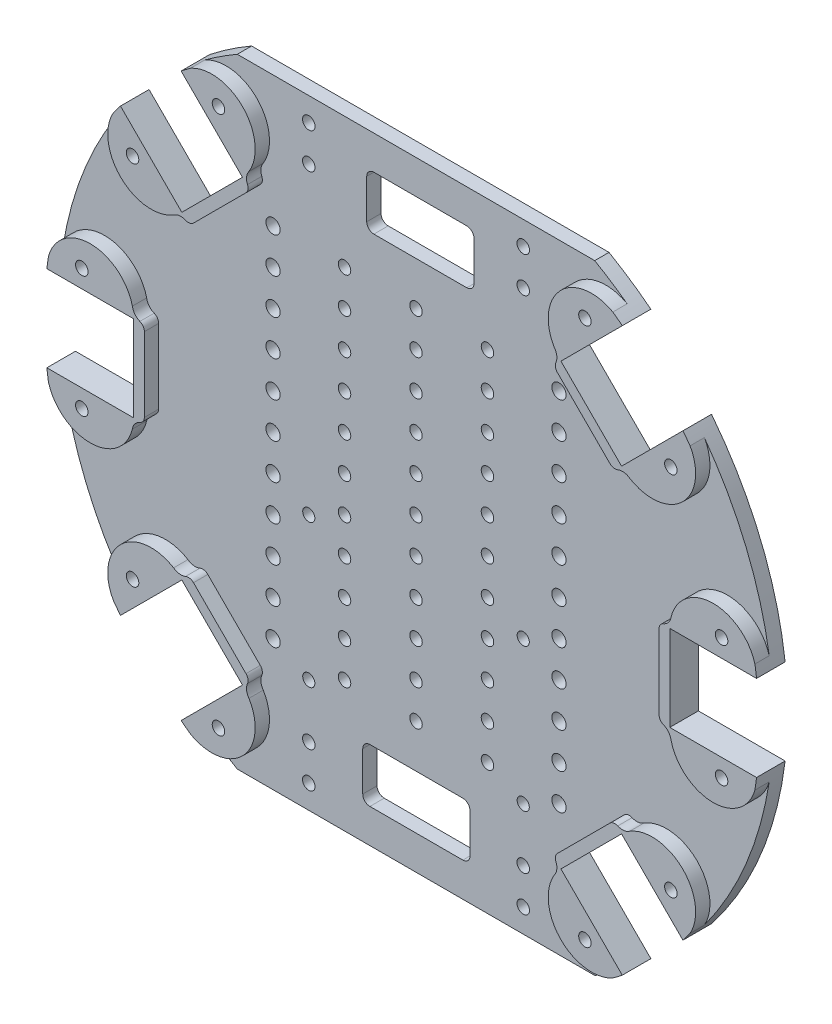
from build123d import *

# Parameters (mm, degrees)
SKETCH1_R           = 1.75
BOSS_EXTRUDE1_DEPTH = 4
SKETCH2_R           = 1.75
SKETCH2_R_2         = 2
SKETCH2_R_3         = 1.7
CUT_EXTRUDE1_DEPTH  = 10
SKETCH3_R           = 1.75
BOSS_EXTRUDE2_DEPTH = 4
CUT_EXTRUDE2_DEPTH  = 10
CUT_EXTRUDE3_DEPTH  = 141.968081494


with BuildPart() as part:
    # Sketch1 → Boss-Extrude1 (new body)
    with BuildSketch(Plane.XY):
        with BuildLine():
            Line((61.518289963, 44.547727215), (44.547727215, 61.518289963))
            Line((44.547727215, 61.518289963), (61.714433725, 78.684996473))
            ThreePointArc((61.714433725, 78.684996473), (0, 100), (-61.714433725, 78.684996473))
            Line((-61.714433725, 78.684996473), (-44.547727215, 61.518289963))
            Line((-44.547727215, 61.518289963), (-61.518289963, 44.547727215))
            Line((-61.518289963, 44.547727215), (-78.684996473, 61.714433725))
            ThreePointArc((-78.684996473, 61.714433725), (-92.387953251, 38.268343237), (-99.277389168, 12))
            Line((-99.277389168, 12), (-75, 12))
            Line((-75, 12), (-75, -12))
            Line((-75, -12), (-99.277389168, -12))
            ThreePointArc((-99.277389168, -12), (-92.387953251, -38.268343237), (-78.684996473, -61.714433725))
            Line((-78.684996473, -61.714433725), (-61.518289963, -44.547727215))
            Line((-61.518289963, -44.547727215), (-44.547727215, -61.518289963))
            Line((-44.547727215, -61.518289963), (-61.714433725, -78.684996473))
            ThreePointArc((-61.714433725, -78.684996473), (0, -100), (61.714433725, -78.684996473))
            Line((61.714433725, -78.684996473), (44.547727215, -61.518289963))
            Line((44.547727215, -61.518289963), (61.518289963, -44.547727215))
            Line((61.518289963, -44.547727215), (78.684996473, -61.714433725))
            ThreePointArc((78.684996473, -61.714433725), (92.387953251, -38.268343237), (99.277389168, -12))
            Line((99.277389168, -12), (75, -12))
            Line((75, -12), (75, 12))
            Line((75, 12), (99.277389168, 12))
            ThreePointArc((99.277389168, 12), (92.387953251, 38.268343237), (78.684996473, 61.714433725))
            Line((78.684996473, 61.714433725), (61.518289963, 44.547727215))
        make_face()
        with Locations((-51.265241636, -75.306872196)):
            Circle(SKETCH1_R, mode=Mode.SUBTRACT)
        with Locations((-75.306872196, -51.265241636)):
            Circle(SKETCH1_R, mode=Mode.SUBTRACT)
        with Locations((-89.5, -17)):
            Circle(SKETCH1_R, mode=Mode.SUBTRACT)
        with Locations((51.265241636, -75.306872196)):
            Circle(SKETCH1_R, mode=Mode.SUBTRACT)
        with Locations((75.306872196, -51.265241636)):
            Circle(SKETCH1_R, mode=Mode.SUBTRACT)
        with Locations((89.5, -17)):
            Circle(SKETCH1_R, mode=Mode.SUBTRACT)
        with Locations((-89.5, 17)):
            Circle(SKETCH1_R, mode=Mode.SUBTRACT)
        with Locations((-75.306872196, 51.265241636)):
            Circle(SKETCH1_R, mode=Mode.SUBTRACT)
        with Locations((-51.265241636, 75.306872196)):
            Circle(SKETCH1_R, mode=Mode.SUBTRACT)
        with Locations((89.5, 17)):
            Circle(SKETCH1_R, mode=Mode.SUBTRACT)
        with Locations((75.306872196, 51.265241636)):
            Circle(SKETCH1_R, mode=Mode.SUBTRACT)
        with Locations((51.265241636, 75.306872196)):
            Circle(SKETCH1_R, mode=Mode.SUBTRACT)
    extrude(amount=BOSS_EXTRUDE1_DEPTH)

    # Sketch2 → Cut-Extrude1 (cut)
    with BuildSketch(Plane.XY.offset(4)):
        with Locations((0, 40)):
            Circle(SKETCH2_R)
        with Locations((-40, 40)):
            Circle(SKETCH2_R_2)
        with Locations((-20, 40)):
            Circle(SKETCH2_R)
        with Locations((-40, 50)):
            Circle(SKETCH2_R_2)
        with Locations((-20, 50)):
            Circle(SKETCH2_R)
        with Locations((-30, 70)):
            Circle(SKETCH2_R)
        with Locations((-30, 80)):
            Circle(SKETCH2_R)
        with Locations((30, 80)):
            Circle(SKETCH2_R)
        with Locations((30, 70)):
            Circle(SKETCH2_R)
        with Locations((40, 50)):
            Circle(SKETCH2_R_2)
        with Locations((20, 50)):
            Circle(SKETCH2_R)
        with Locations((0, 50)):
            Circle(SKETCH2_R)
        with Locations((40, 40)):
            Circle(SKETCH2_R_2)
        with Locations((20, 40)):
            Circle(SKETCH2_R)
        with Locations((30, -80)):
            Circle(SKETCH2_R)
        with Locations((-30, -80)):
            Circle(SKETCH2_R)
        with Locations((30, -70)):
            Circle(SKETCH2_R)
        with Locations((-30, -70)):
            Circle(SKETCH2_R)
        with Locations((0, 10)):
            Circle(SKETCH2_R)
        with Locations((-40, 10)):
            Circle(SKETCH2_R_2)
        with Locations((-20, 10)):
            Circle(SKETCH2_R)
        with Locations((40, 10)):
            Circle(SKETCH2_R_2)
        with Locations((20, 10)):
            Circle(SKETCH2_R)
        with Locations((0, 20)):
            Circle(SKETCH2_R)
        with Locations((-40, 20)):
            Circle(SKETCH2_R_2)
        with Locations((-20, 20)):
            Circle(SKETCH2_R)
        with Locations((40, 20)):
            Circle(SKETCH2_R_2)
        with Locations((20, 20)):
            Circle(SKETCH2_R)
        with Locations((0, 30)):
            Circle(SKETCH2_R)
        with Locations((-40, 30)):
            Circle(SKETCH2_R_2)
        with Locations((-20, 30)):
            Circle(SKETCH2_R)
        with Locations((40, 30)):
            Circle(SKETCH2_R_2)
        with Locations((20, 30)):
            Circle(SKETCH2_R)
        with Locations((0, -10)):
            Circle(SKETCH2_R)
        with Locations((40, -10)):
            Circle(SKETCH2_R_2)
        with Locations((20, -10)):
            Circle(SKETCH2_R)
        with Locations((-40, -10)):
            Circle(SKETCH2_R_2)
        with Locations((-20, -10)):
            Circle(SKETCH2_R)
        with Locations((0, -20)):
            Circle(SKETCH2_R)
        with Locations((40, -20)):
            Circle(SKETCH2_R_2)
        with Locations((20, -20)):
            Circle(SKETCH2_R)
        with Locations((-40, -20)):
            Circle(SKETCH2_R_2)
        with Locations((-20, -20)):
            Circle(SKETCH2_R)
        with Locations((0, -30)):
            Circle(SKETCH2_R)
        with Locations((40, -30)):
            Circle(SKETCH2_R_2)
        with Locations((20, -30)):
            Circle(SKETCH2_R)
        with Locations((-40, -30)):
            Circle(SKETCH2_R_2)
        with Locations((-20, -30)):
            Circle(SKETCH2_R)
        with Locations((0, -40)):
            Circle(SKETCH2_R)
        with Locations((40, -40)):
            Circle(SKETCH2_R_2)
        with Locations((20, -40)):
            Circle(SKETCH2_R)
        with Locations((-40, -40)):
            Circle(SKETCH2_R_2)
        with Locations((-20, -40)):
            Circle(SKETCH2_R)
        with Locations((0, -50)):
            Circle(SKETCH2_R)
        with Locations((40, -50)):
            Circle(SKETCH2_R_2)
        with Locations((20, -50)):
            Circle(SKETCH2_R)
        with Locations((-40, -50)):
            Circle(SKETCH2_R_2)
        with Locations((-20, -50)):
            Circle(SKETCH2_R)
        with Locations((-30, -55)):
            Circle(SKETCH2_R_3)
        with Locations((-30, -15)):
            Circle(SKETCH2_R_3)
        with Locations((30, -55)):
            Circle(SKETCH2_R_3)
        with Locations((30, -15)):
            Circle(SKETCH2_R_3)
        with Locations((-40, 0)):
            Circle(SKETCH2_R_2)
        with Locations((-20, 0)):
            Circle(SKETCH2_R)
        Circle(SKETCH2_R)
        with Locations((40, 0)):
            Circle(SKETCH2_R_2)
        with Locations((20, 0)):
            Circle(SKETCH2_R)
    extrude(amount=-CUT_EXTRUDE1_DEPTH, mode=Mode.SUBTRACT)

    # Sketch3 → Boss-Extrude2 (add)
    # profile 1 of 19: a face of its own
    with BuildSketch(Plane.XY.offset(4)):
        with BuildLine():
            ThreePointArc((42.745208303, -63.818207412), (44.40985161, -78.544869697), (59.074881311, -80.685552598))
            ThreePointArc((59.074881311, -80.685552598), (60.402940433, -79.696203091), (61.714433725, -78.684996473))
            Line((61.714433725, -78.684996473), (44.547727215, -61.518289963))
            ThreePointArc((44.547727215, -61.518289963), (43.738044879, -62.41276888), (43.021158129, -63.383207651))
            ThreePointArc((43.021158129, -63.383207651), (42.89146595, -63.605961831), (42.745208303, -63.818207412))
        make_face()
        with Locations((51.265241636, -75.306872196)):
            Circle(SKETCH3_R, mode=Mode.SUBTRACT)
    # profile 2 of 19: a face of its own
    with BuildSketch(Plane.XY.offset(4)):
        with BuildLine():
            ThreePointArc((43.021158129, -63.383207651), (43.738044879, -62.41276888), (44.547727215, -61.518289963))
            Line((44.547727215, -61.518289963), (61.518289963, -44.547727215))
            ThreePointArc((61.518289963, -44.547727215), (62.41276888, -43.738044879), (63.383207651, -43.021158129))
            ThreePointArc((63.383207651, -43.021158129), (61.934255267, -43.415364041), (60.457290906, -43.144370333))
            ThreePointArc((60.457290906, -43.144370333), (59.291136488, -43.01863263), (58.255022397, -43.568354094))
            Line((58.255022397, -43.568354094), (43.568354094, -58.255022397))
            ThreePointArc((43.568354094, -58.255022397), (43.01863263, -59.291136488), (43.144370333, -60.457290906))
            ThreePointArc((43.144370333, -60.457290906), (43.415364041, -61.934255267), (43.021158129, -63.383207651))
        make_face()
    # profile 3 of 19: a face of its own
    with BuildSketch(Plane.XY.offset(4)):
        with BuildLine():
            ThreePointArc((78.684996473, -61.714433725), (79.696203091, -60.402940433), (80.685552598, -59.074881311))
            ThreePointArc((80.685552598, -59.074881311), (78.544869697, -44.40985161), (63.818207412, -42.745208303))
            ThreePointArc((63.818207412, -42.745208303), (63.605961831, -42.89146595), (63.383207651, -43.021158129))
            ThreePointArc((63.383207651, -43.021158129), (62.41276888, -43.738044879), (61.518289963, -44.547727215))
            Line((61.518289963, -44.547727215), (78.684996473, -61.714433725))
        make_face()
        with Locations((75.306872196, -51.265241636)):
            Circle(SKETCH3_R, mode=Mode.SUBTRACT)
    # profile 4 of 19: a face of its own
    with BuildSketch(Plane.XY.offset(4)):
        with BuildLine():
            Line((99.277389168, -12), (75, -12))
            ThreePointArc((75, -12), (75.059960237, -13.205023978), (75.239248591, -14.398143296))
            ThreePointArc((75.239248591, -14.398143296), (75.305053363, -14.647360506), (75.351713878, -14.90086057))
            ThreePointArc((75.351713878, -14.90086057), (86.942117215, -24.137102766), (98.825550559, -15.281052213))
            ThreePointArc((98.825550559, -15.281052213), (99.065054424, -13.642396857), (99.277389168, -12))
        make_face()
        with Locations((89.5, -17)):
            Circle(SKETCH3_R, mode=Mode.SUBTRACT)
    # profile 5 of 19: a face of its own
    with BuildSketch(Plane.XY.offset(4)):
        with BuildLine():
            Line((75, -12), (75, 12))
            ThreePointArc((75, 12), (75.059960237, 13.205023978), (75.239248591, 14.398143296))
            ThreePointArc((75.239248591, 14.398143296), (74.493430208, 13.094833565), (73.257437204, 12.242083539))
            ThreePointArc((73.257437204, 12.242083539), (72.343931524, 11.506397825), (72, 10.38504275))
            Line((72, 10.38504275), (72, -10.38504275))
            ThreePointArc((72, -10.38504275), (72.343931524, -11.506397825), (73.257437204, -12.242083539))
            ThreePointArc((73.257437204, -12.242083539), (74.493430208, -13.094833565), (75.239248591, -14.398143296))
            ThreePointArc((75.239248591, -14.398143296), (75.059960237, -13.205023978), (75, -12))
        make_face()
    # profile 6 of 19: a face of its own
    with BuildSketch(Plane.XY.offset(4)):
        with BuildLine():
            ThreePointArc((99.277389168, 12), (99.065054424, 13.642396857), (98.825550559, 15.281052213))
            ThreePointArc((98.825550559, 15.281052213), (86.942117215, 24.137102766), (75.351713878, 14.90086057))
            ThreePointArc((75.351713878, 14.90086057), (75.305053363, 14.647360506), (75.239248591, 14.398143296))
            ThreePointArc((75.239248591, 14.398143296), (75.059960237, 13.205023978), (75, 12))
            Line((75, 12), (99.277389168, 12))
        make_face()
        with Locations((89.5, 17)):
            Circle(SKETCH3_R, mode=Mode.SUBTRACT)
    # profile 7 of 19: a face of its own
    with BuildSketch(Plane.XY.offset(4)):
        with BuildLine():
            ThreePointArc((80.685552598, 59.074881311), (79.696203091, 60.402940433), (78.684996473, 61.714433725))
            Line((78.684996473, 61.714433725), (61.518289963, 44.547727215))
            ThreePointArc((61.518289963, 44.547727215), (62.41276888, 43.738044879), (63.383207651, 43.021158129))
            ThreePointArc((63.383207651, 43.021158129), (63.605961831, 42.89146595), (63.818207412, 42.745208303))
            ThreePointArc((63.818207412, 42.745208303), (78.544869697, 44.40985161), (80.685552598, 59.074881311))
        make_face()
        with Locations((75.306872196, 51.265241636)):
            Circle(SKETCH3_R, mode=Mode.SUBTRACT)
    # profile 8 of 19: a face of its own
    with BuildSketch(Plane.XY.offset(4)):
        with BuildLine():
            Line((61.518289963, 44.547727215), (44.547727215, 61.518289963))
            ThreePointArc((44.547727215, 61.518289963), (43.738044879, 62.41276888), (43.021158129, 63.383207651))
            ThreePointArc((43.021158129, 63.383207651), (43.415364041, 61.934255267), (43.144370333, 60.457290906))
            ThreePointArc((43.144370333, 60.457290906), (43.01863263, 59.291136488), (43.568354094, 58.255022397))
            Line((43.568354094, 58.255022397), (58.255022397, 43.568354094))
            ThreePointArc((58.255022397, 43.568354094), (59.291136488, 43.01863263), (60.457290906, 43.144370333))
            ThreePointArc((60.457290906, 43.144370333), (61.934255267, 43.415364041), (63.383207651, 43.021158129))
            ThreePointArc((63.383207651, 43.021158129), (62.41276888, 43.738044879), (61.518289963, 44.547727215))
        make_face()
    # profile 9 of 19: a face of its own
    with BuildSketch(Plane.XY.offset(4)):
        with BuildLine():
            ThreePointArc((61.714433725, 78.684996473), (60.402940433, 79.696203091), (59.074881311, 80.685552598))
            ThreePointArc((59.074881311, 80.685552598), (44.40985161, 78.544869697), (42.745208303, 63.818207412))
            ThreePointArc((42.745208303, 63.818207412), (42.89146595, 63.605961831), (43.021158129, 63.383207651))
            ThreePointArc((43.021158129, 63.383207651), (43.738044879, 62.41276888), (44.547727215, 61.518289963))
            Line((44.547727215, 61.518289963), (61.714433725, 78.684996473))
        make_face()
        with Locations((51.265241636, 75.306872196)):
            Circle(SKETCH3_R, mode=Mode.SUBTRACT)
    # profile 10 of 19: a face of its own
    with BuildSketch(Plane.XY.offset(4)):
        with BuildLine():
            ThreePointArc((-59.074881311, 80.685552598), (-60.402940433, 79.696203091), (-61.714433725, 78.684996473))
            Line((-61.714433725, 78.684996473), (-44.547727215, 61.518289963))
            ThreePointArc((-44.547727215, 61.518289963), (-43.738044879, 62.41276888), (-43.021158129, 63.383207651))
            ThreePointArc((-43.021158129, 63.383207651), (-42.89146595, 63.605961831), (-42.745208303, 63.818207412))
            ThreePointArc((-42.745208303, 63.818207412), (-44.40985161, 78.544869697), (-59.074881311, 80.685552598))
        make_face()
        with Locations((-51.265241636, 75.306872196)):
            Circle(SKETCH3_R, mode=Mode.SUBTRACT)
    # profile 11 of 19: a face of its own
    with BuildSketch(Plane.XY.offset(4)):
        with BuildLine():
            Line((-44.547727215, 61.518289963), (-53.033008589, 53.033008589))
            Line((-53.033008589, 53.033008589), (-50.911688245, 50.911688245))
            Line((-50.911688245, 50.911688245), (-43.568354094, 58.255022397))
            ThreePointArc((-43.568354094, 58.255022397), (-43.01863263, 59.291136488), (-43.144370333, 60.457290906))
            ThreePointArc((-43.144370333, 60.457290906), (-43.415364041, 61.934255267), (-43.021158129, 63.383207651))
            ThreePointArc((-43.021158129, 63.383207651), (-43.738044879, 62.41276888), (-44.547727215, 61.518289963))
        make_face()
    # profile 12 of 19: a face of its own
    with BuildSketch(Plane.XY.offset(4)):
        with BuildLine():
            Line((-53.033008589, 53.033008589), (-61.518289963, 44.547727215))
            ThreePointArc((-61.518289963, 44.547727215), (-62.41276888, 43.738044879), (-63.383207651, 43.021158129))
            ThreePointArc((-63.383207651, 43.021158129), (-61.934255267, 43.415364041), (-60.457290906, 43.144370333))
            ThreePointArc((-60.457290906, 43.144370333), (-59.291136488, 43.01863263), (-58.255022397, 43.568354094))
            Line((-58.255022397, 43.568354094), (-50.911688245, 50.911688245))
            Line((-50.911688245, 50.911688245), (-53.033008589, 53.033008589))
        make_face()
    # profile 13 of 19: a face of its own
    with BuildSketch(Plane.XY.offset(4)):
        with BuildLine():
            Line((-61.518289963, 44.547727215), (-78.684996473, 61.714433725))
            ThreePointArc((-78.684996473, 61.714433725), (-79.696203091, 60.402940433), (-80.685552598, 59.074881311))
            ThreePointArc((-80.685552598, 59.074881311), (-78.544869697, 44.40985161), (-63.818207412, 42.745208303))
            ThreePointArc((-63.818207412, 42.745208303), (-63.605961831, 42.89146595), (-63.383207651, 43.021158129))
            ThreePointArc((-63.383207651, 43.021158129), (-62.41276888, 43.738044879), (-61.518289963, 44.547727215))
        make_face()
        with Locations((-75.306872196, 51.265241636)):
            Circle(SKETCH3_R, mode=Mode.SUBTRACT)
    # profile 14 of 19: a face of its own
    with BuildSketch(Plane.XY.offset(4)):
        with BuildLine():
            ThreePointArc((-75.351713878, 14.90086057), (-86.942117215, 24.137102766), (-98.825550559, 15.281052213))
            ThreePointArc((-98.825550559, 15.281052213), (-99.065054424, 13.642396857), (-99.277389168, 12))
            Line((-99.277389168, 12), (-75, 12))
            ThreePointArc((-75, 12), (-75.059960237, 13.205023978), (-75.239248591, 14.398143296))
            ThreePointArc((-75.239248591, 14.398143296), (-75.305053363, 14.647360506), (-75.351713878, 14.90086057))
        make_face()
        with Locations((-89.5, 17)):
            Circle(SKETCH3_R, mode=Mode.SUBTRACT)
    # profile 15 of 19: a face of its own
    with BuildSketch(Plane.XY.offset(4)):
        with BuildLine():
            ThreePointArc((-75.239248591, 14.398143296), (-75.059960237, 13.205023978), (-75, 12))
            Line((-75, 12), (-75, -12))
            ThreePointArc((-75, -12), (-75.059960237, -13.205023978), (-75.239248591, -14.398143296))
            ThreePointArc((-75.239248591, -14.398143296), (-74.493430208, -13.094833565), (-73.257437204, -12.242083539))
            ThreePointArc((-73.257437204, -12.242083539), (-72.343931524, -11.506397825), (-72, -10.38504275))
            Line((-72, -10.38504275), (-72, 10.38504275))
            ThreePointArc((-72, 10.38504275), (-72.343931524, 11.506397825), (-73.257437204, 12.242083539))
            ThreePointArc((-73.257437204, 12.242083539), (-74.493430208, 13.094833565), (-75.239248591, 14.398143296))
        make_face()
    # profile 16 of 19: a face of its own
    with BuildSketch(Plane.XY.offset(4)):
        with BuildLine():
            Line((-75, -12), (-99.277389168, -12))
            ThreePointArc((-99.277389168, -12), (-99.065054424, -13.642396857), (-98.825550559, -15.281052213))
            ThreePointArc((-98.825550559, -15.281052213), (-86.942117215, -24.137102766), (-75.351713878, -14.90086057))
            ThreePointArc((-75.351713878, -14.90086057), (-75.305053363, -14.647360506), (-75.239248591, -14.398143296))
            ThreePointArc((-75.239248591, -14.398143296), (-75.059960237, -13.205023978), (-75, -12))
        make_face()
        with Locations((-89.5, -17)):
            Circle(SKETCH3_R, mode=Mode.SUBTRACT)
    # profile 17 of 19: a face of its own
    with BuildSketch(Plane.XY.offset(4)):
        with BuildLine():
            ThreePointArc((-63.818207412, -42.745208303), (-78.544869697, -44.40985161), (-80.685552598, -59.074881311))
            ThreePointArc((-80.685552598, -59.074881311), (-79.696203091, -60.402940433), (-78.684996473, -61.714433725))
            Line((-78.684996473, -61.714433725), (-61.518289963, -44.547727215))
            ThreePointArc((-61.518289963, -44.547727215), (-62.41276888, -43.738044879), (-63.383207651, -43.021158129))
            ThreePointArc((-63.383207651, -43.021158129), (-63.605961831, -42.89146595), (-63.818207412, -42.745208303))
        make_face()
        with Locations((-75.306872196, -51.265241636)):
            Circle(SKETCH3_R, mode=Mode.SUBTRACT)
    # profile 18 of 19: a face of its own
    with BuildSketch(Plane.XY.offset(4)):
        with BuildLine():
            ThreePointArc((-63.383207651, -43.021158129), (-62.41276888, -43.738044879), (-61.518289963, -44.547727215))
            Line((-61.518289963, -44.547727215), (-44.547727215, -61.518289963))
            ThreePointArc((-44.547727215, -61.518289963), (-43.738044879, -62.41276888), (-43.021158129, -63.383207651))
            ThreePointArc((-43.021158129, -63.383207651), (-43.415364041, -61.934255267), (-43.144370333, -60.457290906))
            ThreePointArc((-43.144370333, -60.457290906), (-43.01863263, -59.291136488), (-43.568354094, -58.255022397))
            Line((-43.568354094, -58.255022397), (-58.255022397, -43.568354094))
            ThreePointArc((-58.255022397, -43.568354094), (-59.291136488, -43.01863263), (-60.457290906, -43.144370333))
            ThreePointArc((-60.457290906, -43.144370333), (-61.934255267, -43.415364041), (-63.383207651, -43.021158129))
        make_face()
    # profile 19 of 19: a face of its own
    with BuildSketch(Plane.XY.offset(4)):
        with BuildLine():
            Line((-44.547727215, -61.518289963), (-61.714433725, -78.684996473))
            ThreePointArc((-61.714433725, -78.684996473), (-60.402940433, -79.696203091), (-59.074881311, -80.685552598))
            ThreePointArc((-59.074881311, -80.685552598), (-44.40985161, -78.544869697), (-42.745208303, -63.818207412))
            ThreePointArc((-42.745208303, -63.818207412), (-42.89146595, -63.605961831), (-43.021158129, -63.383207651))
            ThreePointArc((-43.021158129, -63.383207651), (-43.738044879, -62.41276888), (-44.547727215, -61.518289963))
        make_face()
        with Locations((-51.265241636, -75.306872196)):
            Circle(SKETCH3_R, mode=Mode.SUBTRACT)
    extrude(amount=BOSS_EXTRUDE2_DEPTH)

    # Sketch4 → Cut-Extrude2 (cut)
    with BuildSketch(Plane.XY.offset(4)):
        with BuildLine():
            Line((13.099983645, -77.099672773), (-12.900016355, -77.099672773))
            ThreePointArc((-12.900016355, -77.099672773), (-14.314229917, -76.513886336), (-14.900016355, -75.099672773))
            Line((-14.900016355, -75.099672773), (-14.900016355, -64.099672773))
            ThreePointArc((-14.900016355, -64.099672773), (-14.314229917, -62.685459211), (-12.900016355, -62.099672773))
            Line((-12.900016355, -62.099672773), (13.099983645, -62.099672773))
            ThreePointArc((13.099983645, -62.099672773), (14.514197207, -62.685459211), (15.099983645, -64.099672773))
            Line((15.099983645, -64.099672773), (15.099983645, -75.099672773))
            ThreePointArc((15.099983645, -75.099672773), (14.514197207, -76.513886336), (13.099983645, -77.099672773))
        make_face()
        with BuildLine():
            Line((14.211764519, 62.127309363), (-11.788235481, 62.127309363))
            ThreePointArc((-11.788235481, 62.127309363), (-13.202449044, 62.713095801), (-13.788235481, 64.127309363))
            Line((-13.788235481, 64.127309363), (-13.788235481, 75.127309363))
            ThreePointArc((-13.788235481, 75.127309363), (-13.202449044, 76.541522925), (-11.788235481, 77.127309363))
            Line((-11.788235481, 77.127309363), (14.211764519, 77.127309363))
            ThreePointArc((14.211764519, 77.127309363), (15.625978081, 76.541522925), (16.211764519, 75.127309363))
            Line((16.211764519, 75.127309363), (16.211764519, 64.127309363))
            ThreePointArc((16.211764519, 64.127309363), (15.625978081, 62.713095801), (14.211764519, 62.127309363))
        make_face()
    extrude(amount=-CUT_EXTRUDE2_DEPTH, mode=Mode.SUBTRACT)

    # Sketch5 → Cut-Extrude3 (cut, through all)
    with BuildSketch(Plane.XY.offset(4)):
        with BuildLine():
            ThreePointArc((-50, -86.602540378), (0, -100), (50, -86.602540378))
            Line((50, -86.602540378), (-50, -86.602540378))
        make_face()
        with BuildLine():
            ThreePointArc((50, 86.602540378), (0, 100), (-50, 86.602540378))
            Line((-50, 86.602540378), (50, 86.602540378))
        make_face()
    extrude(amount=-CUT_EXTRUDE3_DEPTH, mode=Mode.SUBTRACT)


solid = part.part
